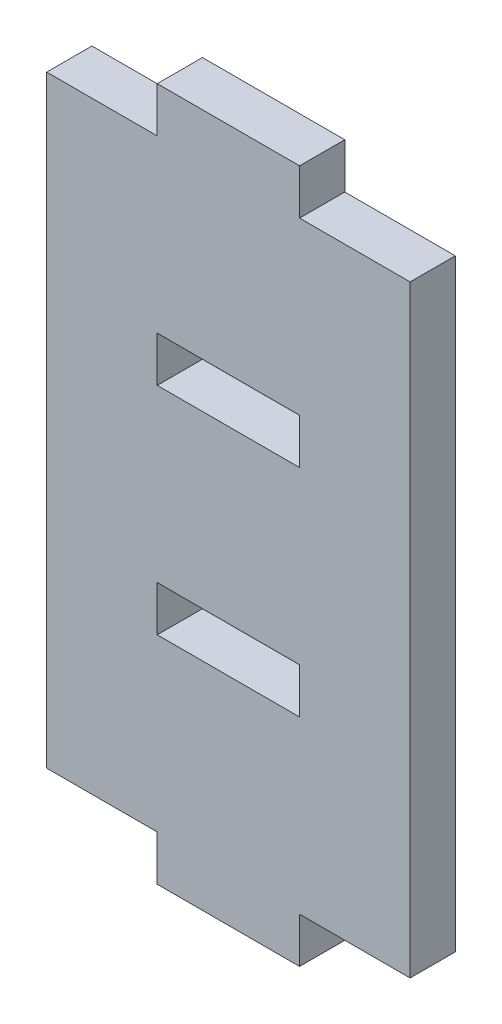
from build123d import *

# Parameters (mm, degrees)
SKETCH1_W           = 10
SKETCH1_H           = 3.18
BOSS_EXTRUDE1_DEPTH = 1.5875


with BuildPart() as part:
    # Sketch1 → Boss-Extrude1 (new, symmetric)
    with BuildSketch(Plane.XY):
        Polygon((0, 0), (0, -3.18), (-10, -3.18), (-10, 0), (-17.765, 0), (-17.765, 42.35), (-10, 42.35), (-10, 45.53), (0, 45.53), (0, 42.35), (7.765, 42.35), (7.765, 0), align=None)
        with Locations((-5, 13.586666667)):
            Rectangle(SKETCH1_W, SKETCH1_H, mode=Mode.SUBTRACT)
        with Locations((-5, 28.763333333)):
            Rectangle(SKETCH1_W, SKETCH1_H, mode=Mode.SUBTRACT)
    extrude(amount=BOSS_EXTRUDE1_DEPTH, both=True)


solid = part.part
